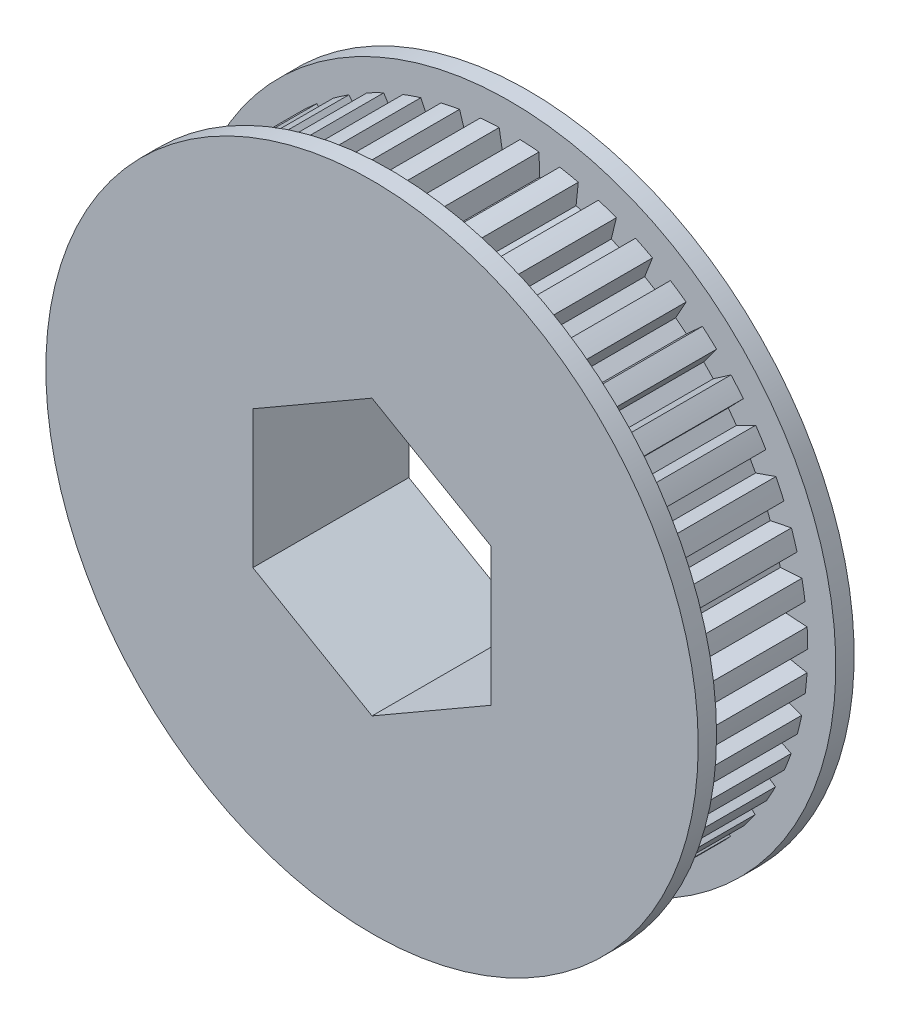
from build123d import *

# Parameters (mm, degrees)
SKETCH3_R               = 16.25
BOSS_EXTRUDE2_DEPTH     = 3.25
CUT_EXTRUDE2_DEPTH      = 24.209642393
CIRPATTERN3_COUNT       = 47
SKETCH5_R               = 17.78
BOSS_EXTRUDE3_DEPTH     = 1
BOSS_EXTRUDE4_START     = 1
SKETCH6_R               = 17.78
BOSS_EXTRUDE4_DEPTH     = 1
CUT_EXTRUDE3_DEPTH      = 27.542546977
CUT_EXTRUDE3_DEPTH_BACK = 27.542546977


with BuildPart() as part:
    # Sketch3 → Boss-Extrude2 (new, symmetric)
    with BuildSketch(Plane.XY):
        with Locations(Location((0, 0, 0), (0, 0, 180))):
            Circle(SKETCH3_R)
    extrude(amount=BOSS_EXTRUDE2_DEPTH, both=True)

    # Sketch1 → Cut-Extrude2 (cut, symmetric)
    with BuildSketch(Plane.XY):
        Polygon((-0.375, 15.08), (0.375, 15.08), (0.654345854, 16.756075122), (-0.654345854, 16.756075122), align=None)
    cut_extrude2 = extrude(amount=CUT_EXTRUDE2_DEPTH, both=True, mode=Mode.SUBTRACT)

    # CirPattern3: Cut-Extrude2 ×47 about axis
    cirpattern3_axis = Axis((0, 0, 0), (0, 0, 1))
    for i in range(1, CIRPATTERN3_COUNT):
        add(cut_extrude2.rotate(cirpattern3_axis, i * 360 / CIRPATTERN3_COUNT), mode=Mode.SUBTRACT)

    # Sketch5 → Boss-Extrude3 (add)
    with BuildSketch(Plane(origin=(0, 0, -3.25), x_dir=(-1, 0, 0), z_dir=(0, 0, -1))):
        Circle(SKETCH5_R)
    extrude(amount=BOSS_EXTRUDE3_DEPTH)

    # Sketch6 → Boss-Extrude4 (add)
    with BuildSketch(Plane.XY.offset(3.25).offset(BOSS_EXTRUDE4_START)):
        with Locations(Location((0, 0, 0), (0, 0, 180))):
            Circle(SKETCH6_R)
    extrude(amount=-BOSS_EXTRUDE4_DEPTH)

    # Sketch7 → Cut-Extrude3 (cut, two sides: drawn at the far end of the back side and taken through both)
    with BuildSketch(Plane.XY.offset(4.25).offset(-CUT_EXTRUDE3_DEPTH_BACK)):
        Polygon((0, 7.5), (-6.495190528, 3.75), (-6.495190528, -3.75), (0, -7.5), (6.495190528, -3.75), (6.495190528, 3.75), align=None)
    extrude(amount=CUT_EXTRUDE3_DEPTH + CUT_EXTRUDE3_DEPTH_BACK, mode=Mode.SUBTRACT)


solid = part.part
